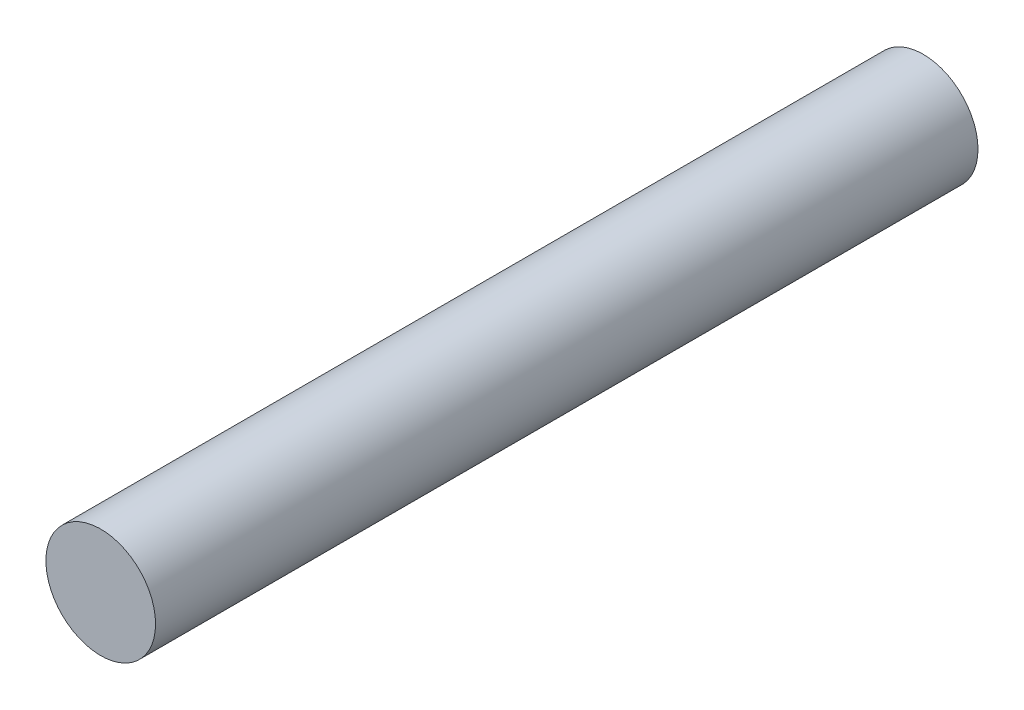
from build123d import *

# Parameters (mm, degrees)
SKETCH_1_R      = 5
EXTRUDE_1_DEPTH = 75


with BuildPart() as part:
    # 草图1 → 凸台-拉伸1 (new body)
    with BuildSketch(Plane.XY):
        Circle(SKETCH_1_R)
    extrude(amount=EXTRUDE_1_DEPTH)


solid = part.part
